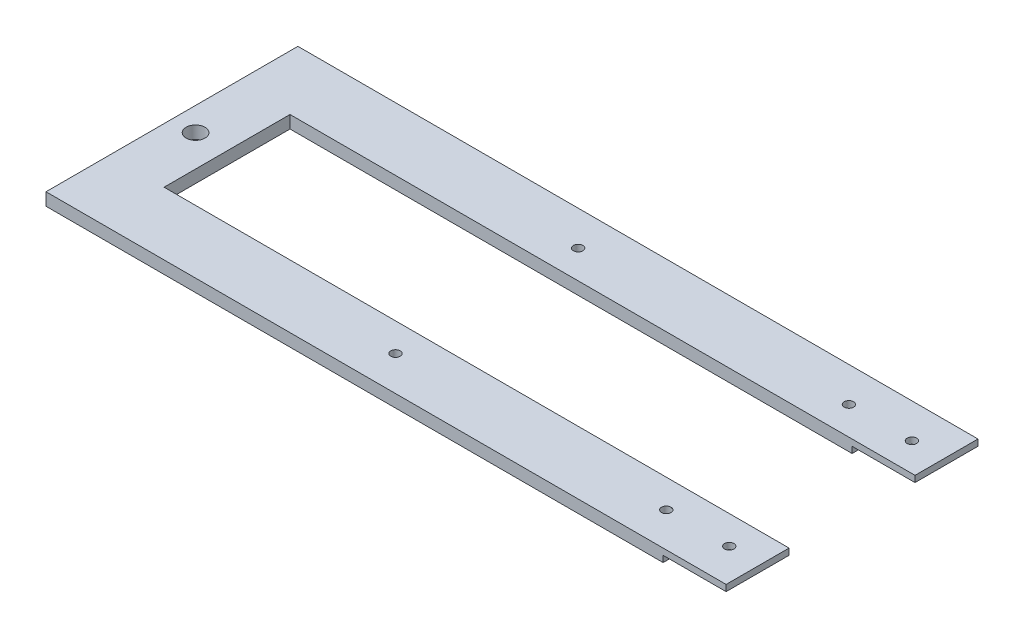
from build123d import *

# Parameters (mm, degrees)
SKETCH1_R           = 1.5
BOSS_EXTRUDE1_DEPTH = 4
SKETCH2_W           = 20
SKETCH2_H           = 2
BOSS_EXTRUDE2_DEPTH = 20
CUT_EXTRUDE1_START  = -10
SKETCH4_R           = 1.5
CUT_EXTRUDE1_DEPTH  = 10


with BuildPart() as part:
    # Sketch1 → Boss-Extrude1 (new body)
    # profile 1 of 2: a face of its own
    with BuildSketch(Plane(origin=(0, 0, 0), x_dir=(1, 0, 0), z_dir=(0, 1, 0))):
        with BuildLine():
            Line((0, 0), (0, -40))
            Line((0, -40), (196, -40))
            Line((196, -40), (196, -20))
            Line((196, -20), (17.5, -20))
            Line((17.5, -20), (17.5, 0))
            Line((17.5, 0), (10.5, 0))
            ThreePointArc((10.5, 0), (7.5, -3), (4.5, 0))
            Line((4.5, 0), (0, 0))
        make_face()
        with Locations(Location((100, -29, 0), (0, 0, 270))):
            Circle(SKETCH1_R, mode=Mode.SUBTRACT)
        with Locations(Location((186, -29, 0), (0, 0, 270))):
            Circle(SKETCH1_R, mode=Mode.SUBTRACT)
    # profile 2 of 2: a face of its own
    with BuildSketch(Plane(origin=(0, 0, 0), x_dir=(1, 0, 0), z_dir=(0, 1, 0))):
        with BuildLine():
            Line((0, 40), (0, 0))
            Line((0, 0), (4.5, 0))
            ThreePointArc((4.5, 0), (7.5, 3), (10.5, 0))
            Line((10.5, 0), (17.5, 0))
            Line((17.5, 0), (17.5, 20))
            Line((17.5, 20), (196, 20))
            Line((196, 20), (196, 40))
            Line((196, 40), (0, 40))
        make_face()
        with Locations(Location((100, 29, 0), (0, 0, 270))):
            Circle(SKETCH1_R, mode=Mode.SUBTRACT)
        with Locations(Location((186, 29, 0), (0, 0, 270))):
            Circle(SKETCH1_R, mode=Mode.SUBTRACT)
    extrude(amount=BOSS_EXTRUDE1_DEPTH)

    # Sketch2 → Boss-Extrude2 (add)
    with BuildSketch(Plane(origin=(196, 0, 0), x_dir=(0, 0, -1), z_dir=(1, 0, 0))):
        with Locations((30, 3)):
            Rectangle(SKETCH2_W, SKETCH2_H)
        with Locations((-30, 3)):
            Rectangle(SKETCH2_W, SKETCH2_H)
    extrude(amount=BOSS_EXTRUDE2_DEPTH)

    # Sketch4 → Cut-Extrude1 (cut)
    with BuildSketch(Plane(origin=(0, 4, 0), x_dir=(1, 0, 0), z_dir=(0, 1, 0)).offset(CUT_EXTRUDE1_START)):
        with Locations(Location((186, 29, 0), (0, 0, 270))):
            Circle(SKETCH4_R)
        with Locations(Location((186, -29, 0), (0, 0, 270))):
            Circle(SKETCH4_R)
        with Locations(Location((206, 29, 0), (0, 0, 270))):
            Circle(SKETCH4_R)
        with Locations(Location((206, -29, 0), (0, 0, 270))):
            Circle(SKETCH4_R)
    extrude(amount=CUT_EXTRUDE1_DEPTH, mode=Mode.SUBTRACT)


solid = part.part
